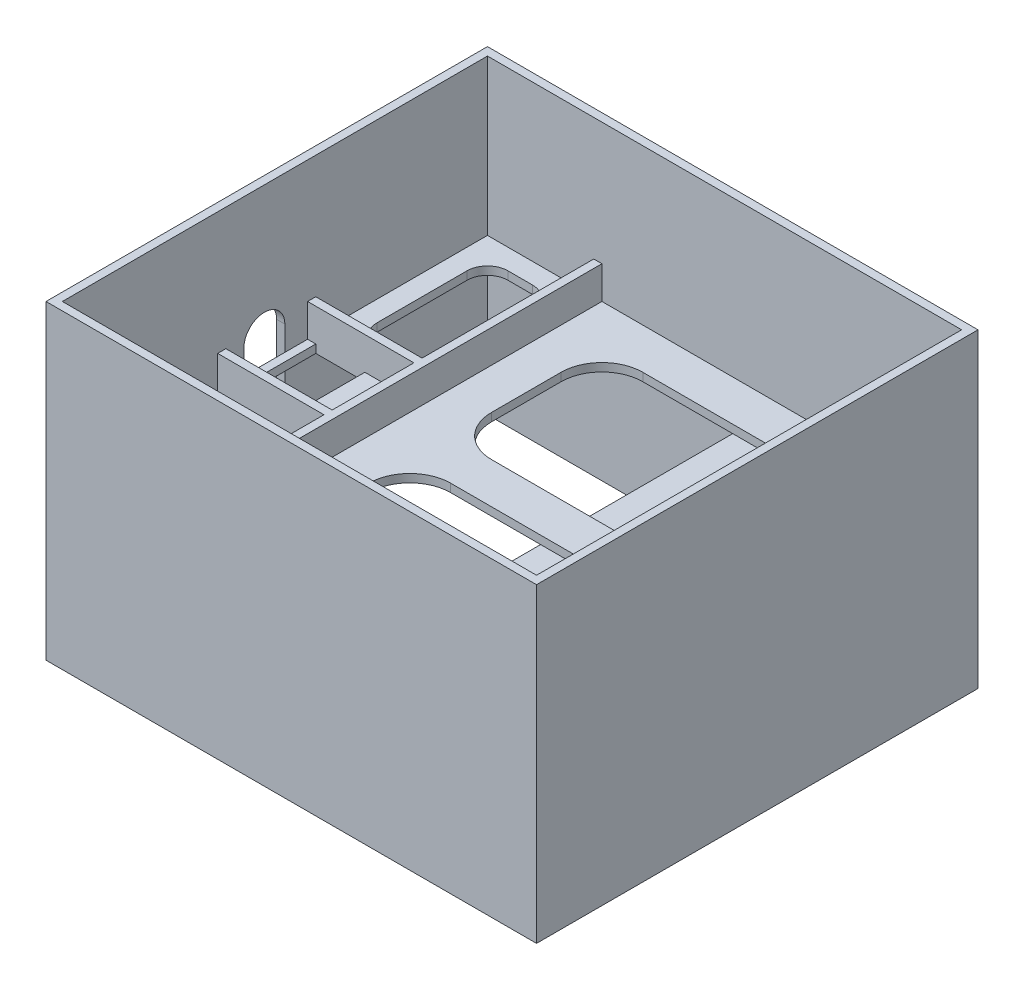
from build123d import *

# Parameters (mm, degrees)
SKETCH1_W           = 60
SKETCH1_H           = 54
BOSS_EXTRUDE1_DEPTH = 38
SKETCH2_W           = 44
SKETCH2_H           = 52
CUT_EXTRUDE1_DEPTH  = 19
SKETCH3_W           = 35
SKETCH3_H           = 52
CUT_EXTRUDE2_DEPTH  = 18
SKETCH4_W           = 6
SKETCH4_H           = 10
CUT_EXTRUDE3_DEPTH  = 38
SKETCH5_W           = 14
SKETCH5_H           = 52
CUT_EXTRUDE5_DEPTH  = 15
SKETCH6_W           = 13
SKETCH6_H           = 52
CUT_EXTRUDE6_DEPTH  = 4
SKETCH8_W           = 15
SKETCH8_H           = 13
CUT_EXTRUDE7_DEPTH  = 6
SKETCH10_W          = 13
SKETCH10_H          = 5
CUT_EXTRUDE8_DEPTH  = 6
SKETCH11_W          = 4
SKETCH11_H          = 5
CUT_EXTRUDE9_DEPTH  = 3
SKETCH12_W          = 5
SKETCH12_H          = 2
CUT_EXTRUDE10_DEPTH = 13
CUT_EXTRUDE11_DEPTH = 1
SKETCH14_W          = 13
SKETCH14_H          = 1
BOSS_EXTRUDE2_DEPTH = 4
SKETCH15_W          = 13
SKETCH15_H          = 1
BOSS_EXTRUDE3_DEPTH = 4
CUT_EXTRUDE12_DEPTH = 1
CUT_EXTRUDE13_DEPTH = 1


with BuildPart() as part:
    # Sketch1 → Boss-Extrude1 (new body)
    with BuildSketch(Plane(origin=(0, 0, 0), x_dir=(1, 0, 0), z_dir=(0, 1, 0))):
        with Locations((-83.874465942, -33.946435202)):
            Rectangle(SKETCH1_W, SKETCH1_H)
    extrude(amount=BOSS_EXTRUDE1_DEPTH)

    # Sketch2 → Cut-Extrude1 (cut)
    with BuildSketch(Plane(origin=(0, 38, 0), x_dir=(1, 0, 0), z_dir=(0, 1, 0))):
        with Locations((-76.874465942, -33.946435202)):
            Rectangle(SKETCH2_W, SKETCH2_H)
    extrude(amount=-CUT_EXTRUDE1_DEPTH, mode=Mode.SUBTRACT)

    # Sketch3 → Cut-Extrude2 (cut)
    with BuildSketch(Plane(origin=(0, 0, 0), x_dir=(-1, 0, 0), z_dir=(0, -1, 0))):
        with Locations((95.374465942, -33.946435202)):
            Rectangle(SKETCH3_W, SKETCH3_H)
    extrude(amount=-CUT_EXTRUDE2_DEPTH, mode=Mode.SUBTRACT)

    # Sketch4 → Cut-Extrude3 (cut)
    with BuildSketch(Plane(origin=(0, 18, 0), x_dir=(-1, 0, 0), z_dir=(0, -1, 0))):
        with Locations((108.874465942, -34.946435202)):
            Rectangle(SKETCH4_W, SKETCH4_H)
    extrude(amount=-CUT_EXTRUDE3_DEPTH, mode=Mode.SUBTRACT)

    # Sketch5 → Cut-Extrude5 (cut)
    with BuildSketch(Plane(origin=(0, 38, 0), x_dir=(1, 0, 0), z_dir=(0, 1, 0))):
        with Locations((-105.874465942, -33.946435202)):
            Rectangle(SKETCH5_W, SKETCH5_H)
    extrude(amount=-CUT_EXTRUDE5_DEPTH, mode=Mode.SUBTRACT)

    # Sketch6 → Cut-Extrude6 (cut)
    with BuildSketch(Plane(origin=(0, 23, 0), x_dir=(1, 0, 0), z_dir=(0, 1, 0))):
        with Locations((-106.374465942, -33.946435202)):
            Rectangle(SKETCH6_W, SKETCH6_H)
    extrude(amount=-CUT_EXTRUDE6_DEPTH, mode=Mode.SUBTRACT)

    # Sketch8 → Cut-Extrude7 (cut)
    with BuildSketch(Plane(origin=(0, 0, 0), x_dir=(-1, 0, 0), z_dir=(0, -1, 0))):
        with Locations((65.874465942, -17.946435202)):
            Rectangle(SKETCH8_W, SKETCH8_H)
    extrude(amount=-CUT_EXTRUDE7_DEPTH, mode=Mode.SUBTRACT)

    # Sketch10 → Cut-Extrude8 (cut)
    with BuildSketch(Plane(origin=(-73.374465942, 0, 0), x_dir=(0, 0, -1), z_dir=(1, 0, 0))):
        with Locations((-17.946435202, 3.5)):
            Rectangle(SKETCH10_W, SKETCH10_H)
    extrude(amount=-CUT_EXTRUDE8_DEPTH, mode=Mode.SUBTRACT)

    # Sketch11 → Cut-Extrude9 (cut)
    with BuildSketch(Plane.XZ):
        with Locations((-65.874465942, 48.446435202)):
            Rectangle(SKETCH11_W, SKETCH11_H)
    extrude(amount=-CUT_EXTRUDE9_DEPTH, mode=Mode.SUBTRACT)

    # Sketch12 → Cut-Extrude10 (cut)
    with BuildSketch(Plane(origin=(-67.874465942, 0, 0), x_dir=(0, 0, -1), z_dir=(1, 0, 0))):
        with Locations((-48.446435202, 2)):
            Rectangle(SKETCH12_W, SKETCH12_H)
    extrude(amount=-CUT_EXTRUDE10_DEPTH, mode=Mode.SUBTRACT)

    # Sketch13 → Cut-Extrude11 (cut)
    with BuildSketch(Plane.ZY.offset(113.874465942)):
        with BuildLine():
            Line((32.733045904, 15), (32.733045904, 22))
            ThreePointArc((32.733045904, 22), (35.233045904, 24.5), (37.733045904, 22))
            Line((37.733045904, 22), (37.733045904, 15))
            ThreePointArc((37.733045904, 15), (35.233045904, 12.5), (32.733045904, 15))
        make_face()
    extrude(amount=-CUT_EXTRUDE11_DEPTH, mode=Mode.SUBTRACT)

    # Sketch14 → Boss-Extrude2 (add)
    with BuildSketch(Plane(origin=(0, 19, 0), x_dir=(1, 0, 0), z_dir=(0, 1, 0))):
        with Locations((-106.374465942, -40.446435202)):
            Rectangle(SKETCH14_W, SKETCH14_H)
    extrude(amount=BOSS_EXTRUDE2_DEPTH)

    # Sketch15 → Boss-Extrude3 (add)
    with BuildSketch(Plane(origin=(0, 19, 0), x_dir=(1, 0, 0), z_dir=(0, 1, 0))):
        with Locations((-106.374465942, -29.446435202)):
            Rectangle(SKETCH15_W, SKETCH15_H)
    extrude(amount=BOSS_EXTRUDE3_DEPTH)

    # Sketch16 → Cut-Extrude12 (cut)
    with BuildSketch(Plane(origin=(0, 19, 0), x_dir=(1, 0, 0), z_dir=(0, 1, 0))):
        with BuildLine():
            Line((-64.874465942, -54.946435202), (-88.874465942, -54.946435202))
            ThreePointArc((-88.874465942, -54.946435202), (-92.409999848, -53.481969108), (-93.874465942, -49.946435202))
            Line((-93.874465942, -49.946435202), (-93.874465942, -41.446435202))
            ThreePointArc((-93.874465942, -41.446435202), (-92.409999848, -37.910901296), (-88.874465942, -36.446435202))
            Line((-88.874465942, -36.446435202), (-64.874465942, -36.446435202))
            ThreePointArc((-64.874465942, -36.446435202), (-61.338932037, -37.910901296), (-59.874465942, -41.446435202))
            Line((-59.874465942, -41.446435202), (-59.874465942, -49.946435202))
            ThreePointArc((-59.874465942, -49.946435202), (-61.338932037, -53.481969108), (-64.874465942, -54.946435202))
        make_face()
        with BuildLine():
            Line((-88.874465942, -31.446435202), (-64.874465942, -31.446435202))
            ThreePointArc((-64.874465942, -31.446435202), (-61.338932037, -29.981969108), (-59.874465942, -26.446435202))
            Line((-59.874465942, -26.446435202), (-59.874465942, -17.946435202))
            ThreePointArc((-59.874465942, -17.946435202), (-61.338932037, -14.410901296), (-64.874465942, -12.946435202))
            Line((-64.874465942, -12.946435202), (-88.874465942, -12.946435202))
            ThreePointArc((-88.874465942, -12.946435202), (-92.409999848, -14.410901296), (-93.874465942, -17.946435202))
            Line((-93.874465942, -17.946435202), (-93.874465942, -26.446435202))
            ThreePointArc((-93.874465942, -26.446435202), (-92.409999848, -29.981969108), (-88.874465942, -31.446435202))
        make_face()
    extrude(amount=-CUT_EXTRUDE12_DEPTH, mode=Mode.SUBTRACT)

    # Sketch17 → Cut-Extrude13 (cut)
    with BuildSketch(Plane(origin=(0, 19, 0), x_dir=(1, 0, 0), z_dir=(0, 1, 0))):
        with BuildLine():
            Line((-104.874465942, -57.446435202), (-107.874465942, -57.446435202))
            ThreePointArc((-107.874465942, -57.446435202), (-109.642232895, -56.714202155), (-110.374465942, -54.946435202))
            Line((-110.374465942, -54.946435202), (-110.374465942, -45.946435202))
            ThreePointArc((-110.374465942, -45.946435202), (-109.642232895, -44.178668249), (-107.874465942, -43.446435202))
            Line((-107.874465942, -43.446435202), (-104.874465942, -43.446435202))
            ThreePointArc((-104.874465942, -43.446435202), (-103.10669899, -44.178668249), (-102.374465942, -45.946435202))
            Line((-102.374465942, -45.946435202), (-102.374465942, -54.946435202))
            ThreePointArc((-102.374465942, -54.946435202), (-103.10669899, -56.714202155), (-104.874465942, -57.446435202))
        make_face()
        with BuildLine():
            Line((-104.874465942, -26.446435202), (-107.874465942, -26.446435202))
            ThreePointArc((-107.874465942, -26.446435202), (-109.642232895, -25.714202155), (-110.374465942, -23.946435202))
            Line((-110.374465942, -23.946435202), (-110.374465942, -12.946435202))
            ThreePointArc((-110.374465942, -12.946435202), (-109.642232895, -11.178668249), (-107.874465942, -10.446435202))
            Line((-107.874465942, -10.446435202), (-104.874465942, -10.446435202))
            ThreePointArc((-104.874465942, -10.446435202), (-103.10669899, -11.178668249), (-102.374465942, -12.946435202))
            Line((-102.374465942, -12.946435202), (-102.374465942, -23.946435202))
            ThreePointArc((-102.374465942, -23.946435202), (-103.10669899, -25.714202155), (-104.874465942, -26.446435202))
        make_face()
    extrude(amount=-CUT_EXTRUDE13_DEPTH, mode=Mode.SUBTRACT)


solid = part.part
